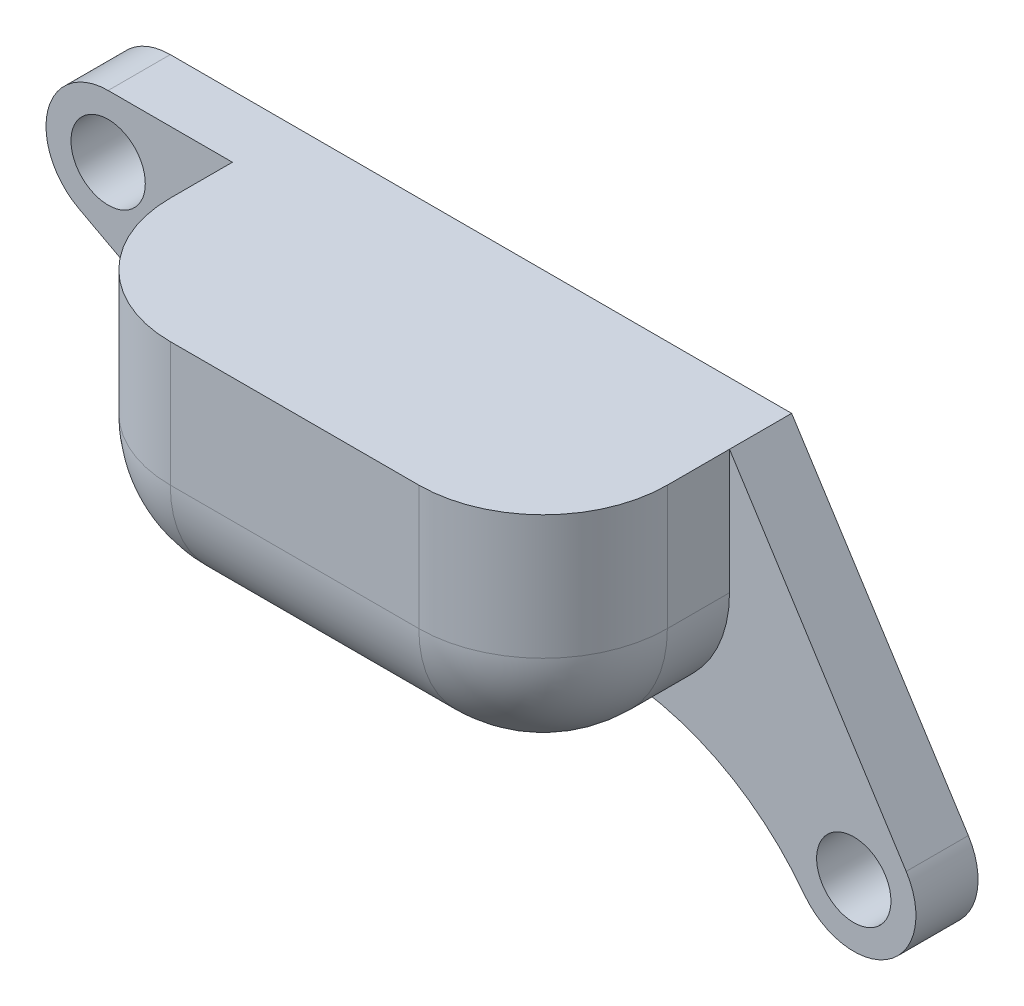
from build123d import *

# Parameters (mm, degrees)
BOSS_EXTRUDE1_DEPTH   = 12.7
BOSS_EXTRUDE2_DEPTH   = 3.175
FILLET1_R             = 6.35
F_6_CLEARANCE_HOLE1_D = 3.7973


with BuildPart() as part:
    # Sketch1 → Boss-Extrude1 (new body)
    with BuildSketch(Plane.XY):
        with BuildLine():
            Line((-12.7, 0), (12.7, 0))
            Line((12.7, 0), (12.7, -6.35))
            ThreePointArc((12.7, -6.35), (10.840128061, -10.840128061), (6.35, -12.7))
            Line((6.35, -12.7), (-6.35, -12.7))
            ThreePointArc((-6.35, -12.7), (-10.840128061, -10.840128061), (-12.7, -6.35))
            Line((-12.7, -6.35), (-12.7, 0))
        make_face()
    extrude(amount=BOSS_EXTRUDE1_DEPTH)

    # Sketch2 → Boss-Extrude2 (add)
    with BuildSketch(Plane(origin=(0, 0, 0), x_dir=(-1, 0, 0), z_dir=(0, 0, -1))):
        with BuildLine():
            Line((12.7, 0), (12.7, -6.35))
            ThreePointArc((12.7, -6.35), (11.795080078, -9.617048047), (9.338235294, -11.952941176))
            Line((9.338235294, -11.952941176), (20.544117647, -5.976470588))
            ThreePointArc((20.544117647, -5.976470588), (22.130202438, -2.404949391), (19.05, 0))
            Line((19.05, 0), (12.7, 0))
        make_face()
        with BuildLine():
            Line((-12.7, 0), (-21.727676004, -14.168929598))
            ThreePointArc((-21.727676004, -14.168929598), (-20.856846986, -18.485733416), (-16.51, -17.78))
            ThreePointArc((-16.51, -17.78), (-12.029612663, -14.040774674), (-6.35, -12.7))
            ThreePointArc((-6.35, -12.7), (-10.840128061, -10.840128061), (-12.7, -6.35))
            Line((-12.7, -6.35), (-12.7, 0))
        make_face()
    extrude(amount=-BOSS_EXTRUDE2_DEPTH)

    # Fillet1
    fillet1_edges = [part.edges().sort_by_distance(p)[0] for p in [
        (-12.7, -3.175, 12.7),
        (-10.840128061, -10.840128061, 12.7),
        (0, -12.7, 12.7),
        (10.840128061, -10.840128061, 12.7),
        (12.7, -3.175, 12.7),
    ]]
    fillet(fillet1_edges, radius=FILLET1_R)

    # #6 Clearance Hole1 (through all)
    with Locations(Plane.XY.offset(3.175)):
        with Locations((-19.05, -3.175), (19.05, -15.875)):
            Hole(F_6_CLEARANCE_HOLE1_D / 2)


solid = part.part
